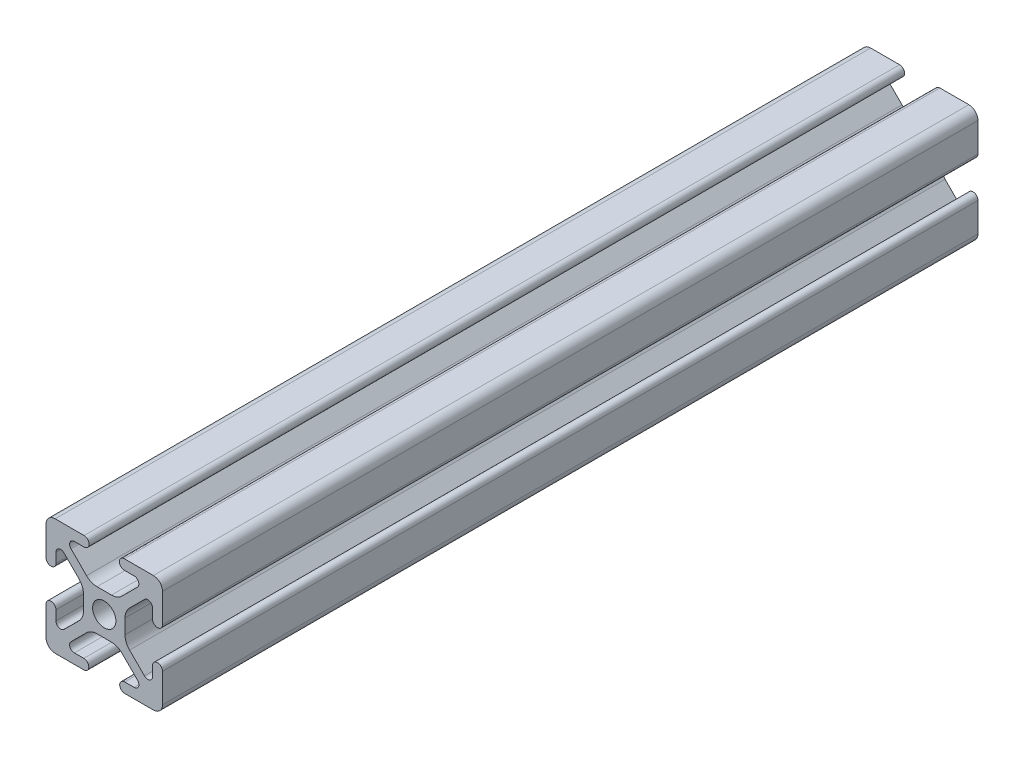
from build123d import *

# Parameters (mm, degrees)
SKETCH1_R          = 2.5
EXTRUDE1_DEPTH     = 175
SKETCH2_R          = 0.494082288
CUT_EXTRUDE1_DEPTH = 177.263218015


with BuildPart() as part:
    # Sketch1 → Extrude1 (new body)
    with BuildSketch(Plane.XY):
        with BuildLine():
            Line((-8.636346088, 7.111588351), (-5.432204773, 3.912143135))
            ThreePointArc((-5.432204773, 3.912143135), (-4.708985779, 2.831057106), (-4.455, 1.555406707))
            Line((-4.455, 1.555406707), (-4.455, -1.555406707))
            ThreePointArc((-4.455, -1.555406707), (-4.708985779, -2.831057106), (-5.432204773, -3.912143135))
            Line((-5.432204773, -3.912143135), (-8.636346088, -7.111588351))
            ThreePointArc((-8.636346088, -7.111588351), (-9.736852394, -7.329863489), (-10.36, -6.396886949))
            Line((-10.36, -6.396886949), (-10.36, -4.32))
            ThreePointArc((-10.36, -4.32), (-11.43, -3.25), (-12.5, -4.32))
            Line((-12.5, -4.32), (-12.5, -8.651801989))
            Line((-12.5, -8.651801989), (-12.5, -10.537068835))
            ThreePointArc((-12.5, -10.537068835), (-11.925070773, -11.925070773), (-10.537068835, -12.5))
            Line((-10.537068835, -12.5), (-8.441567612, -12.5))
            Line((-8.441567612, -12.5), (-4.387856959, -12.5))
            ThreePointArc((-4.387856959, -12.5), (-3.317856959, -11.43), (-4.387856959, -10.36))
            Line((-4.387856959, -10.36), (-6.42, -10.36))
            ThreePointArc((-6.42, -10.36), (-7.35325999, -9.736168088), (-7.133653912, -8.635298598))
            Line((-7.133653912, -8.635298598), (-3.795290766, -5.301828272))
            ThreePointArc((-3.795290766, -5.301828272), (-2.76743922, -4.61585726), (-1.555406707, -4.375))
            Line((-1.555406707, -4.375), (1.555406707, -4.375))
            ThreePointArc((1.555406707, -4.375), (2.76743922, -4.61585726), (3.795290766, -5.301828272))
            Line((3.795290766, -5.301828272), (7.133653912, -8.635298598))
            ThreePointArc((7.133653912, -8.635298598), (7.35325999, -9.736168088), (6.42, -10.36))
            Line((6.42, -10.36), (4.387856959, -10.36))
            ThreePointArc((4.387856959, -10.36), (3.317856959, -11.43), (4.387856959, -12.5))
            Line((4.387856959, -12.5), (8.441567612, -12.5))
            Line((8.441567612, -12.5), (10.537068835, -12.5))
            ThreePointArc((10.537068835, -12.5), (11.925070773, -11.925070773), (12.5, -10.537068835))
            Line((12.5, -10.537068835), (12.5, -8.651801989))
            Line((12.5, -8.651801989), (12.5, -4.32))
            ThreePointArc((12.5, -4.32), (11.43, -3.25), (10.36, -4.32))
            Line((10.36, -4.32), (10.36, -6.396886949))
            ThreePointArc((10.36, -6.396886949), (9.736852394, -7.329863489), (8.636346088, -7.111588351))
            Line((8.636346088, -7.111588351), (5.432204773, -3.912143135))
            ThreePointArc((5.432204773, -3.912143135), (4.708985779, -2.831057106), (4.455, -1.555406707))
            Line((4.455, -1.555406707), (4.455, 1.555406707))
            ThreePointArc((4.455, 1.555406707), (4.708985779, 2.831057106), (5.432204773, 3.912143135))
            Line((5.432204773, 3.912143135), (8.636346088, 7.111588351))
            ThreePointArc((8.636346088, 7.111588351), (9.736852394, 7.329863489), (10.36, 6.396886949))
            Line((10.36, 6.396886949), (10.36, 4.32))
            ThreePointArc((10.36, 4.32), (11.43, 3.25), (12.5, 4.32))
            Line((12.5, 4.32), (12.5, 7.99129648))
            Line((12.5, 7.99129648), (12.5, 10.537068835))
            ThreePointArc((12.5, 10.537068835), (11.925070773, 11.925070773), (10.537068835, 12.5))
            Line((10.537068835, 12.5), (4.32, 12.5))
            ThreePointArc((4.32, 12.5), (3.25, 11.43), (4.32, 10.36))
            Line((4.32, 10.36), (6.42, 10.36))
            ThreePointArc((6.42, 10.36), (7.35325999, 9.736168088), (7.133653912, 8.635298598))
            Line((7.133653912, 8.635298598), (3.795290766, 5.301828272))
            ThreePointArc((3.795290766, 5.301828272), (2.76743922, 4.61585726), (1.555406707, 4.375))
            Line((1.555406707, 4.375), (-1.555406707, 4.375))
            ThreePointArc((-1.555406707, 4.375), (-2.76743922, 4.61585726), (-3.795290766, 5.301828272))
            Line((-3.795290766, 5.301828272), (-7.133653912, 8.635298598))
            ThreePointArc((-7.133653912, 8.635298598), (-7.35325999, 9.736168088), (-6.42, 10.36))
            Line((-6.42, 10.36), (-4.32, 10.36))
            ThreePointArc((-4.32, 10.36), (-3.25, 11.43), (-4.32, 12.5))
            Line((-4.32, 12.5), (-10.537068835, 12.5))
            ThreePointArc((-10.537068835, 12.5), (-11.925070773, 11.925070773), (-12.5, 10.537068835))
            Line((-12.5, 10.537068835), (-12.5, 7.99129648))
            Line((-12.5, 7.99129648), (-12.5, 4.32))
            ThreePointArc((-12.5, 4.32), (-11.43, 3.25), (-10.36, 4.32))
            Line((-10.36, 4.32), (-10.36, 6.396886949))
            ThreePointArc((-10.36, 6.396886949), (-9.736852394, 7.329863489), (-8.636346088, 7.111588351))
        make_face()
        Circle(SKETCH1_R, mode=Mode.SUBTRACT)
    extrude(amount=-EXTRUDE1_DEPTH)

    # Sketch2 → Cut-Extrude1 (cut, through all)
    with BuildSketch(Plane(origin=(4.455, 0, 0), x_dir=(0, 0, -1), z_dir=(1, 0, 0))):
        with Locations((14.055513528, 0)):
            Circle(SKETCH2_R)
    extrude(amount=-CUT_EXTRUDE1_DEPTH, mode=Mode.SUBTRACT)


solid = part.part
